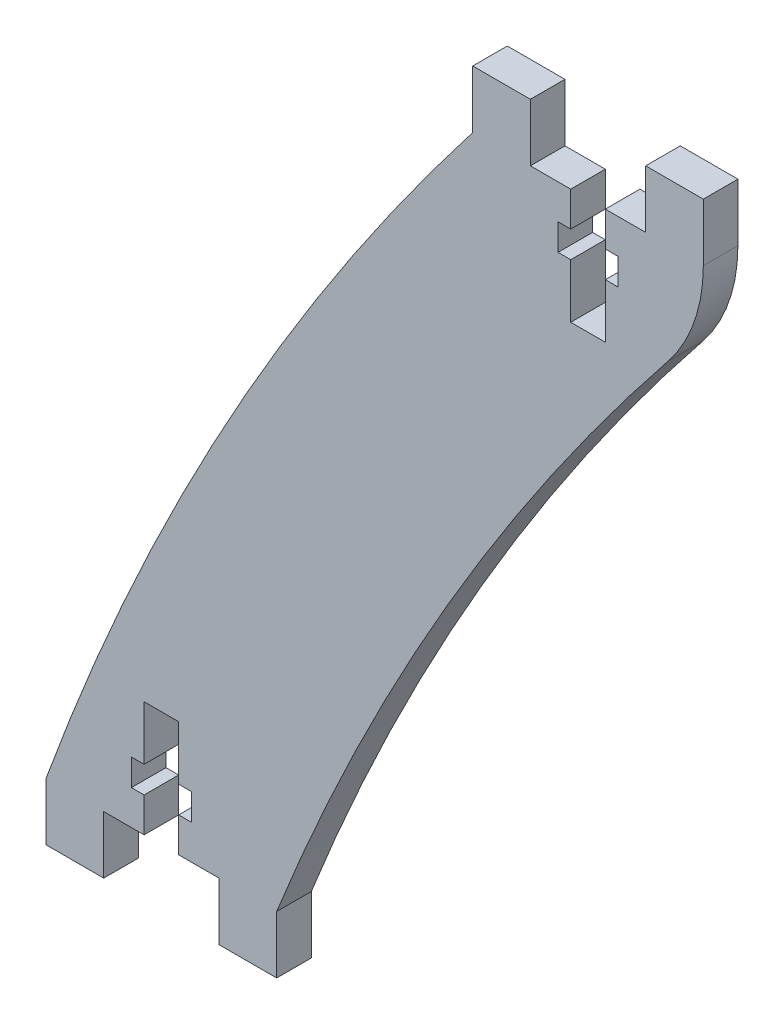
from build123d import *

# Parameters (mm, degrees)
BOSS_EXTRUDE1_DEPTH = 3


with BuildPart() as part:
    # Sketch1 → Boss-Extrude1 (new body)
    with BuildSketch(Plane.XY):
        with BuildLine():
            Line((61.5, 67), (65, 67))
            Line((65, 67), (65, 72))
            Line((65, 72), (70, 72))
            Line((70, 72), (70, 67))
            ThreePointArc((70, 67), (69.214355639, 62.39189998), (66.946189304, 58.304450367))
            ThreePointArc((66.946189304, 58.304450367), (47.808545449, 30.412475413), (33, 0))
            Line((33, 0), (33, -5))
            Line((33, -5), (28, -5))
            Line((28, -5), (28, 0))
            Line((28, 0), (24.5, 0))
            Line((24.5, 0), (24.5, 3))
            Line((24.5, 3), (25.6, 3))
            Line((25.6, 3), (25.6, 5.3))
            Line((25.6, 5.3), (24.5, 5.3))
            Line((24.5, 5.3), (24.5, 10))
            Line((24.5, 10), (21.5, 10))
            Line((21.5, 10), (21.5, 5.3))
            Line((21.5, 5.3), (20.4, 5.3))
            Line((20.4, 5.3), (20.4, 3))
            Line((20.4, 3), (21.5, 3))
            Line((21.5, 3), (21.5, 0))
            Line((21.5, 0), (18, 0))
            Line((18, 0), (18, -5))
            Line((18, -5), (13, -5))
            Line((13, -5), (13, 0))
            ThreePointArc((13, 0), (28.890205099, 34.94123002), (50, 67))
            Line((50, 67), (50, 72))
            Line((50, 72), (55, 72))
            Line((55, 72), (55, 67))
            Line((55, 67), (58.5, 67))
            Line((58.5, 67), (58.5, 64))
            Line((58.5, 64), (57.4, 64))
            Line((57.4, 64), (57.4, 61.7))
            Line((57.4, 61.7), (58.5, 61.7))
            Line((58.5, 61.7), (58.5, 57))
            Line((58.5, 57), (61.5, 57))
            Line((61.5, 57), (61.5, 61.7))
            Line((61.5, 61.7), (62.6, 61.7))
            Line((62.6, 61.7), (62.6, 64))
            Line((62.6, 64), (61.5, 64))
            Line((61.5, 64), (61.5, 67))
        make_face()
    extrude(amount=BOSS_EXTRUDE1_DEPTH)


solid = part.part
